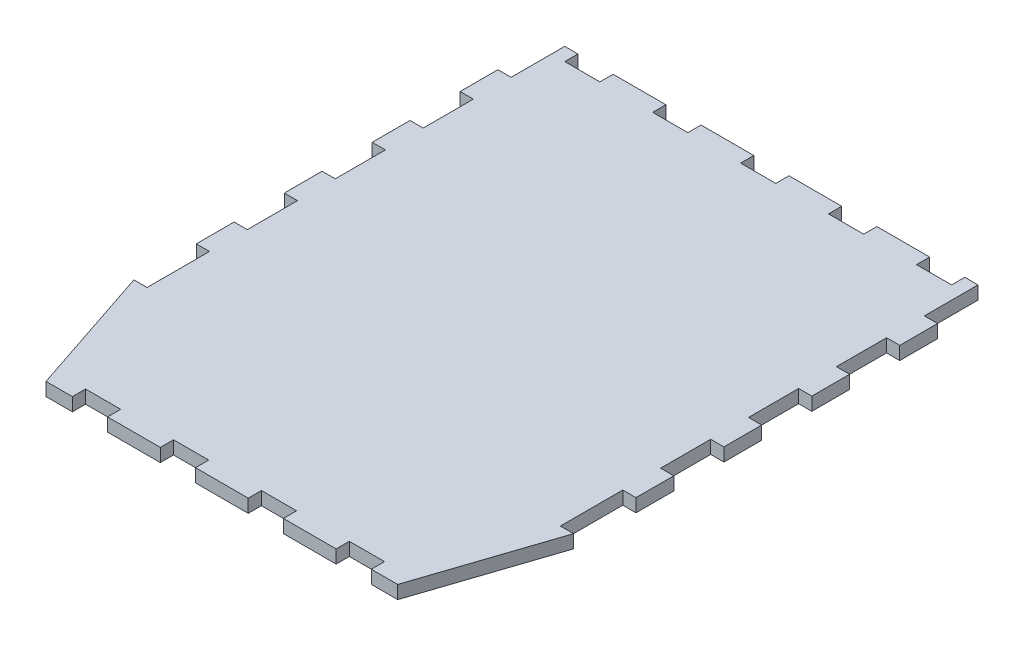
from build123d import *

# Parameters (mm, degrees)
BOSS_EXTRU_1_DEPTH = 3


with BuildPart() as part:
    # Esquisse1 → Boss.-Extru.1 (new body)
    with BuildSketch(Plane(origin=(0, 0, 0), x_dir=(1, 0, 0), z_dir=(0, 1, 0))):
        Polygon((3, 0), (0, 0), (10, -30), (16, -30), (16, -27), (24, -27), (24, -30), (36, -30), (36, -27), (44, -27), (44, -30), (56, -30), (56, -27), (64, -27), (64, -30), (76, -30), (76, -27), (84, -27), (84, -30), (90, -30), (100, 0), (97, 0), (97, 14.2), (100, 14.2), (100, 22.8), (97, 22.8), (97, 34.2), (100, 34.2), (100, 42.8), (97, 42.8), (97, 54.2), (100, 54.2), (100, 62.8), (97, 62.8), (97, 74.2), (100, 74.2), (100, 82.8), (97, 82.8), (97, 95), (94, 95), (94, 92), (86, 92), (86, 95), (74, 95), (74, 92), (66, 92), (66, 95), (54, 95), (54, 92), (46, 92), (46, 95), (34, 95), (34, 92), (26, 92), (26, 95), (14, 95), (14, 92), (6, 92), (6, 95), (3, 95), (3, 82.8), (0, 82.8), (0, 74.2), (3, 74.2), (3, 62.8), (0, 62.8), (0, 54.2), (3, 54.2), (3, 42.8), (0, 42.8), (0, 34.2), (3, 34.2), (3, 22.8), (0, 22.8), (0, 14.2), (3, 14.2), align=None)
    extrude(amount=BOSS_EXTRU_1_DEPTH)


solid = part.part
